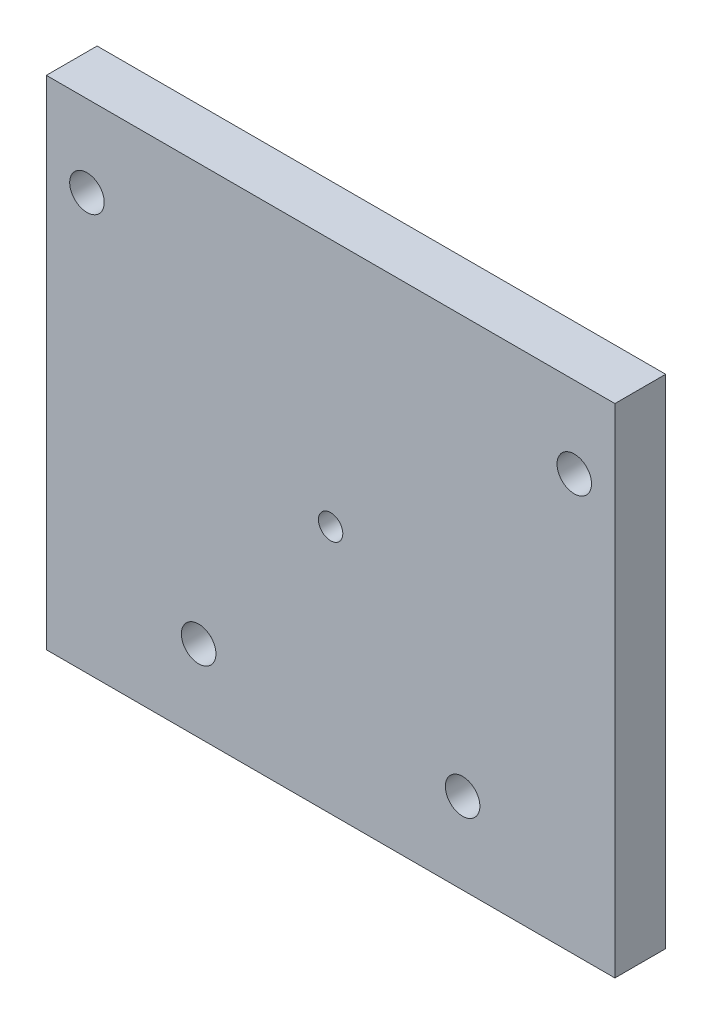
from build123d import *

# Parameters (mm, degrees)
SKETCH1_W           = 280
SKETCH1_H           = 245
SKETCH1_R           = 5.25
SKETCH1_R_2         = 6
BOSS_EXTRUDE1_DEPTH = 25
SKETCH2_R           = 8.5
CUT_EXTRUDE1_DEPTH  = 12


with BuildPart() as part:
    # Sketch1 → Boss-Extrude1 (new body)
    with BuildSketch(Plane.XY):
        Rectangle(SKETCH1_W, SKETCH1_H)
        with Locations((-120, 82.5)):
            Circle(SKETCH1_R, mode=Mode.SUBTRACT)
        with Locations((120, 82.5)):
            Circle(SKETCH1_R, mode=Mode.SUBTRACT)
        with Locations((-65, -82.5)):
            Circle(SKETCH1_R, mode=Mode.SUBTRACT)
        with Locations((65, -82.5)):
            Circle(SKETCH1_R, mode=Mode.SUBTRACT)
        Circle(SKETCH1_R_2, mode=Mode.SUBTRACT)
    extrude(amount=BOSS_EXTRUDE1_DEPTH)

    # Sketch2 → Cut-Extrude1 (cut)
    with BuildSketch(Plane.XY.offset(25)):
        with Locations((-120, 82.5)):
            Circle(SKETCH2_R)
        with Locations((120, 82.5)):
            Circle(SKETCH2_R)
        with Locations((65, -82.5)):
            Circle(SKETCH2_R)
        with Locations((-65, -82.5)):
            Circle(SKETCH2_R)
    extrude(amount=-CUT_EXTRUDE1_DEPTH, mode=Mode.SUBTRACT)


solid = part.part
